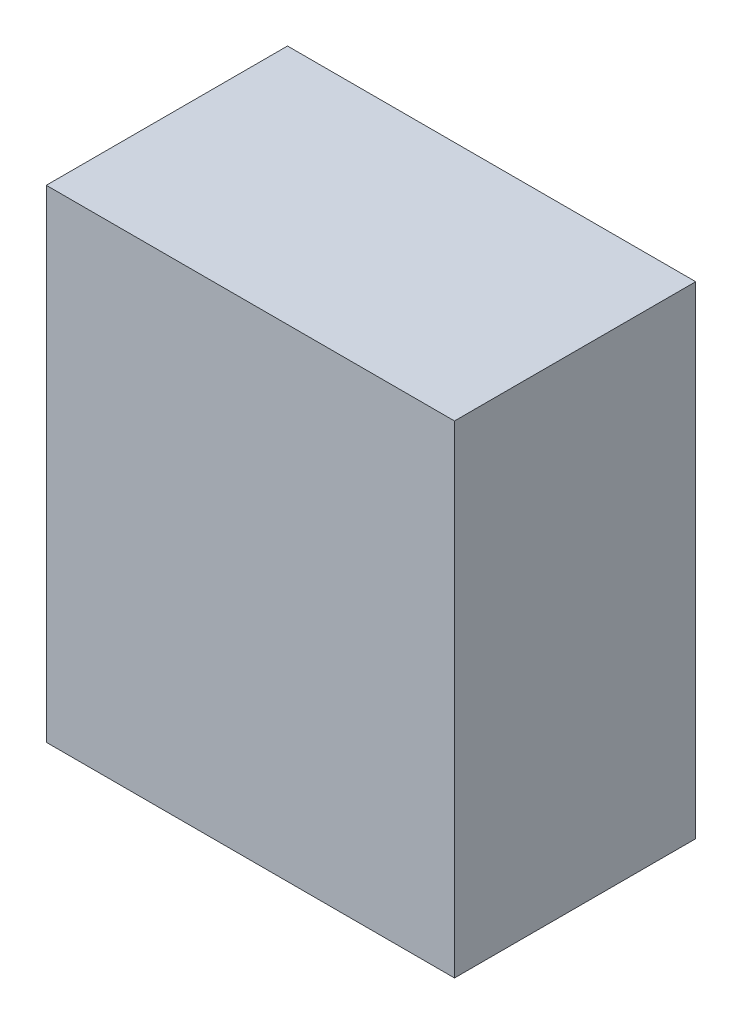
from build123d import *

# Parameters (mm, degrees)
BOSS_EXTRUDE1_DEPTH = 10
SKETCH2_W           = 22
SKETCH2_H           = 26
BOSS_EXTRUDE2_DEPTH = 3


with BuildPart() as part:
    # Sketch1 → Boss-Extrude1 (new body)
    with BuildSketch(Plane.XY):
        Polygon((-11.840425532, -6.996736248), (-11.840425532, 9.003263752), (-14.840425532, 9.003263752), (-14.840425532, -9.996736248), (7.159574468, -9.996736248), (7.159574468, 16.003263752), (-14.840425532, 16.003263752), (-14.840425532, 13.003263752), (4.159574468, 13.003263752), (4.159574468, -6.996736248), align=None)
    extrude(amount=BOSS_EXTRUDE1_DEPTH)

    # Sketch2 → Boss-Extrude2 (add)
    with BuildSketch(Plane.XY.offset(10)):
        with Locations((-3.840425532, 3.003263752)):
            Rectangle(SKETCH2_W, SKETCH2_H)
    extrude(amount=BOSS_EXTRUDE2_DEPTH)


solid = part.part
